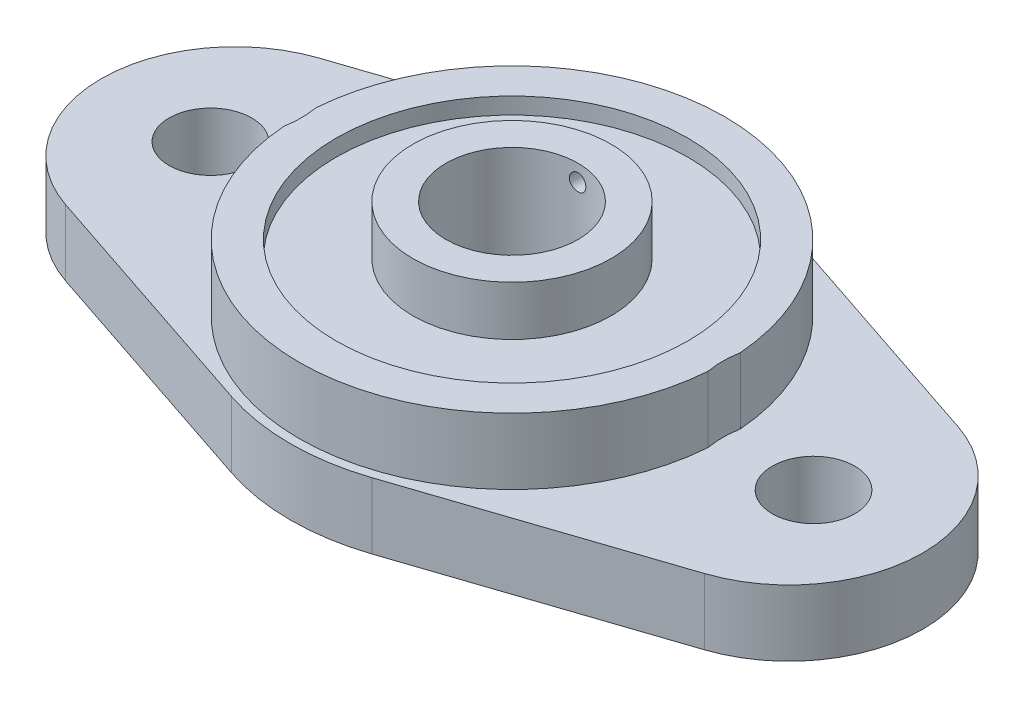
from build123d import *

# Parameters (mm, degrees)
SKETCH1_R           = 10.64
BOSS_EXTRUDE1_DEPTH = 4
SKETCH2_R           = 12.875
SKETCH2_R_2         = 10.64
BOSS_EXTRUDE2_DEPTH = 4
SKETCH3_R           = 6
SKETCH3_R_2         = 4
BOSS_EXTRUDE3_DEPTH = 10
SKETCH5_R           = 2.5
CUT_EXTRUDE1_DEPTH  = 4
SKETCH6_R           = 10.64
SKETCH6_R_2         = 6
BOSS_EXTRUDE4_DEPTH = 7
SKETCH7_R           = 5.5
CUT_EXTRUDE2_DEPTH  = 4
SKETCH8_R           = 0.5
CUT_EXTRUDE3_DEPTH  = 30.964106861


with BuildPart() as part:
    # Sketch1 → Boss-Extrude1 (new body)
    with BuildSketch(Plane(origin=(0, 0, 0), x_dir=(1, 0, 0), z_dir=(0, 1, 0))):
        with BuildLine():
            Line((-4.248633652, 12.719167115), (-19.326288783, 7.682718392))
            ThreePointArc((-19.326288783, 7.682718392), (-24.86, 0), (-19.326288783, -7.682718392))
            Line((-19.326288783, -7.682718392), (-4.248633652, -12.719167115))
            ThreePointArc((-4.248633652, -12.719167115), (0, -13.41), (4.248633652, -12.719167115))
            Line((4.248633652, -12.719167115), (19.326288783, -7.682718392))
            ThreePointArc((19.326288783, -7.682718392), (24.86, 0), (19.326288783, 7.682718392))
            Line((19.326288783, 7.682718392), (4.248633652, 12.719167115))
            ThreePointArc((4.248633652, 12.719167115), (0, 13.41), (-4.248633652, 12.719167115))
        make_face()
        with Locations(Location((0, 0, 0), (0, 0, 270))):
            Circle(SKETCH1_R, mode=Mode.SUBTRACT)
    extrude(amount=BOSS_EXTRUDE1_DEPTH)

    # Sketch2 → Boss-Extrude2 (add)
    with BuildSketch(Plane(origin=(0, 4, 0), x_dir=(1, 0, 0), z_dir=(0, 1, 0))):
        with Locations(Location((0, 0, 0), (0, 0, 270))):
            Circle(SKETCH2_R)
        with Locations(Location((0, 0, 0), (0, 0, 270))):
            Circle(SKETCH2_R_2, mode=Mode.SUBTRACT)
    extrude(amount=BOSS_EXTRUDE2_DEPTH)

    # Sketch5 → Cut-Extrude1 (cut)
    with BuildSketch(Plane(origin=(0, 0, 0), x_dir=(1, 0, 0), z_dir=(0, 1, 0))):
        with Locations(Location((-18.25, 0, 0), (0, 0, 270))):
            Circle(SKETCH5_R)
        with Locations(Location((18.25, 0, 0), (0, 0, 270))):
            Circle(SKETCH5_R)
    extrude(amount=CUT_EXTRUDE1_DEPTH, mode=Mode.SUBTRACT)



with BuildPart() as body_2:
    # Sketch3 → Boss-Extrude3 (new body)
    with BuildSketch(Plane(origin=(0, 0, 0), x_dir=(1, 0, 0), z_dir=(0, 1, 0))):
        with Locations(Location((0, 0, 0), (0, 0, 270))):
            Circle(SKETCH3_R)
        with Locations(Location((0, 0, 0), (0, 0, 270))):
            Circle(SKETCH3_R_2, mode=Mode.SUBTRACT)
    extrude(amount=BOSS_EXTRUDE3_DEPTH)


with BuildPart() as part_1:
    add(part.part)

    add(body_2.part)  # Boss-Extrude4 merges body 2
    # Sketch6 → Boss-Extrude4 (add)
    with BuildSketch(Plane(origin=(0, 0, 0), x_dir=(1, 0, 0), z_dir=(0, 1, 0))):
        with Locations(Location((0, 0, 0), (0, 0, 270))):
            Circle(SKETCH6_R)
        with Locations(Location((0, 0, 0), (0, 0, 270))):
            Circle(SKETCH6_R_2, mode=Mode.SUBTRACT)
    extrude(amount=BOSS_EXTRUDE4_DEPTH)

    # Sketch7 → Cut-Extrude2 (cut)
    with BuildSketch(Plane(origin=(0, 8, 0), x_dir=(1, 0, 0), z_dir=(0, 1, 0))):
        with Locations((-18.25, 0)):
            Circle(SKETCH7_R)
        with Locations((18.25, 0)):
            Circle(SKETCH7_R)
    extrude(amount=-CUT_EXTRUDE2_DEPTH, mode=Mode.SUBTRACT)

    # Sketch8 → Cut-Extrude3 (cut, through all)
    with BuildSketch(Plane.XY):
        with Locations(Location((0, 9, 0), (0, 0, 90))):
            Circle(SKETCH8_R)
    extrude(amount=-CUT_EXTRUDE3_DEPTH, mode=Mode.SUBTRACT)


solid = part_1.part
